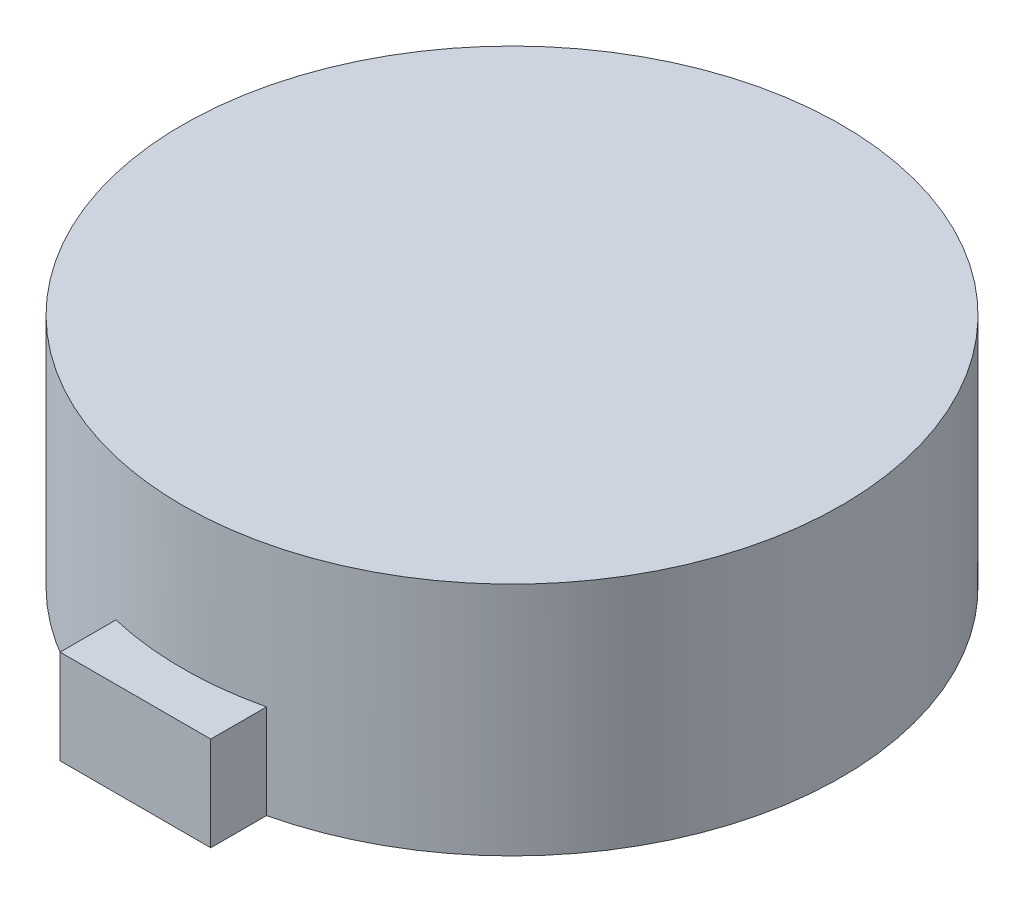
from build123d import *

# Parameters (mm, degrees)
SKETCH1_R           = 4.445
BOSS_EXTRUDE1_DEPTH = 3.175
BOSS_EXTRUDE2_DEPTH = 1.27


with BuildPart() as part:
    # Sketch1 → Boss-Extrude1 (new body)
    with BuildSketch(Plane(origin=(0, 0, 0), x_dir=(1, 0, 0), z_dir=(0, 1, 0))):
        with Locations(Location((0, 0, 0), (0, 0, 270))):
            Circle(SKETCH1_R)
    extrude(amount=BOSS_EXTRUDE1_DEPTH)

    # Sketch3 → Boss-Extrude2 (add)
    with BuildSketch(Plane.XZ):
        with BuildLine():
            Line((0, 4.445), (0, 5.08))
            Line((0, 5.08), (-1.016, 5.08))
            Line((-1.016, 5.08), (-1.016, 4.327328159))
            ThreePointArc((-1.016, 4.327328159), (-0.511395801, 4.415484043), (0, 4.445))
        make_face()
        with BuildLine():
            Line((1.016, 4.327328159), (1.016, 5.08))
            Line((1.016, 5.08), (0, 5.08))
            Line((0, 5.08), (0, 4.445))
            ThreePointArc((0, 4.445), (0.511395801, 4.415484043), (1.016, 4.327328159))
        make_face()
    extrude(amount=-BOSS_EXTRUDE2_DEPTH)


solid = part.part
